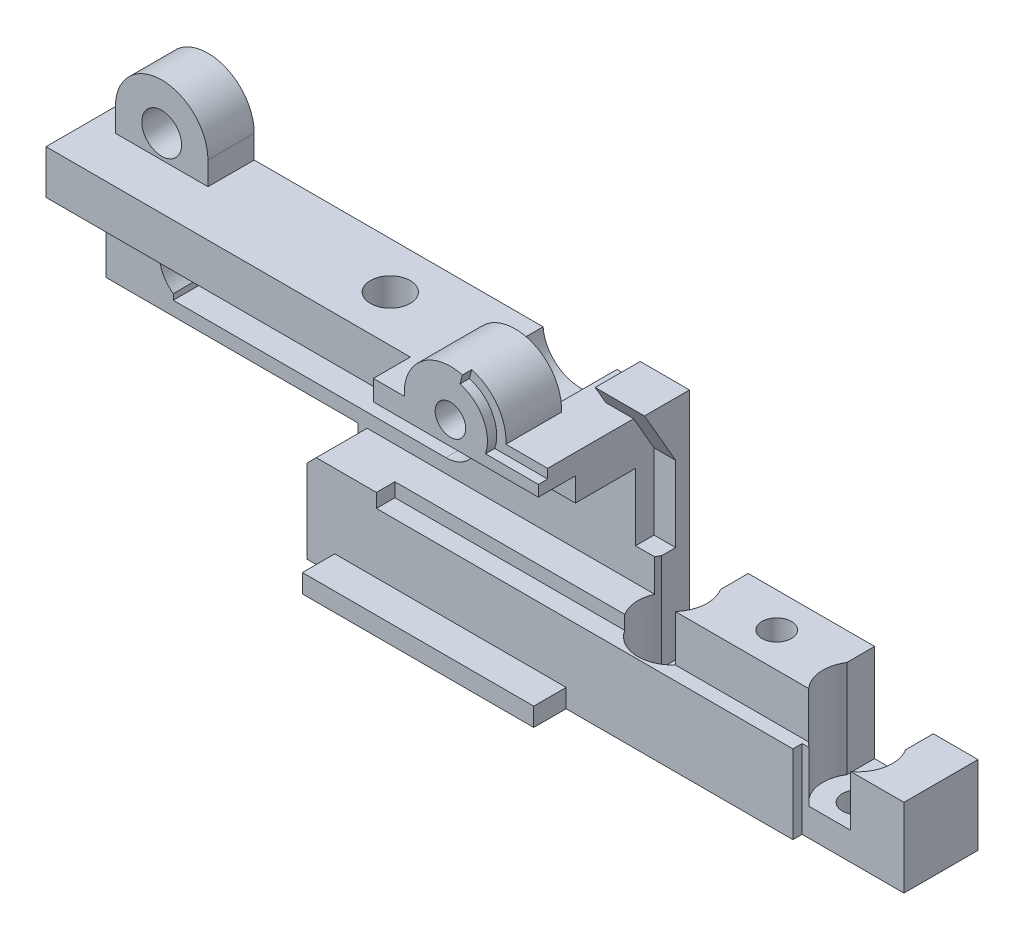
from build123d import *
from build123d.topology import SkipClean

# Parameters (mm, degrees)
SKETCH_1_W                   = 63.5
SKETCH_1_H                   = 8
SKETCH_1_R                   = 1.65
EXTRUDE_1_DEPTH              = 3
SKETCH_4_W                   = 52.5
SKETCH_4_H                   = 1
EXTRUDE_3_DEPTH              = 3
EXTRUDE_4_DEPTH              = 5.5
EXTRUDE_5_DEPTH              = 1.5
EXTRUDE_5_DIRECTION_2_REACH  = 38.844
CHAMFER_1_SIZE               = 1
SKETCH_8_W                   = 22
SKETCH_8_H                   = 3.5
EXTRUDE_6_DEPTH              = 12.5
EXTRUDE_7_DEPTH              = 5
SKETCH_11_W                  = 10
SKETCH_11_H                  = 2
CUT_EXTRUDE_1_DEPTH          = 5
CUT_EXTRUDE_3_DEPTH          = 43.388087949
EXTRUDE_8_DEPTH              = 3.5
SKETCH_16_W                  = 3.5
SKETCH_16_H                  = 4
EXTRUDE_9_DEPTH              = 8
SKETCH_2_W                   = 10
SKETCH_2_H                   = 2
EXTRUDE_2_DEPTH              = 3
SKETCH_17_W                  = 30
SKETCH_17_H                  = 4.75
EXTRUDE_10_DEPTH             = 10
EXTRUDE_11_DEPTH             = 17
EXTRUDE_12_REACH             = 44.326
SKETCH_19_W                  = 2.327855615
SKETCH_19_H                  = 3
SKETCH_19_W_2                = 13.65571123
SKETCH_19_W_3                = 4.827855615
SKETCH_21_R                  = 1.65
CUT_EXTRUDE_4_DEPTH          = 45.838599443
EXTRUDE_13_DEPTH             = 4
EXTRUDE_13_DEPTH_BACK        = 3
SKETCH_23_R                  = 4
CUT_EXTRUDE_5_DEPTH          = 48.517260022
SKETCH_24_W                  = 5.169872981
SKETCH_24_H                  = 2.2
SKETCH_24_W_2                = 4
EXTRUDE_14_DEPTH             = 4
CUT_EXTRUDE_6_DEPTH          = 1
SKETCH_26_R                  = 2.15
CUT_EXTRUDE_7_DEPTH          = 4.75
EXTRUDE_15_DEPTH             = 3.5
SKETCH_28_W                  = 6.5
SKETCH_28_H                  = 4.75
EXTRUDE_16_DEPTH             = 27.2
SKETCH_29_R                  = 2.15
EXTRUDE_17_DEPTH             = 5
SKETCH_30_R                  = 1.6
CUT_EXTRUDE_8_DEPTH          = 5
SKETCH_31_W                  = 28
SKETCH_31_H                  = 2
EXTRUDE_18_DEPTH             = 3.5
CUT_EXTRUDE_9_DEPTH          = 2.5
EXTRUDE_19_DEPTH             = 1.5
SKETCH_34_W                  = 4
SKETCH_34_H                  = 12
CUT_EXTRUDE_10_DEPTH         = 67.647130471
SKETCH_35_W                  = 4.827855615
SKETCH_35_H                  = 3
CUT_EXTRUDE_11_DEPTH         = 5
SKETCH_36_W                  = 2.327855615
SKETCH_36_H                  = 1.5
EXTRUDE_20_DEPTH             = 14
SKETCH_37_W                  = 3
SKETCH_37_H                  = 1.5
EXTRUDE_21_DEPTH             = 2
SKETCH_38_W                  = 3
SKETCH_38_H                  = 3.5
CUT_EXTRUDE_12_DEPTH         = 10
SKETCH_39_W                  = 2
SKETCH_39_H                  = 7
CUT_EXTRUDE_13_DEPTH         = 3.5
EXTRUDE_22_REACH             = 68.647
EXTRUDE_22_DIRECTION_2_REACH = 68.647


with BuildPart() as part:
    # 草图1 → 凸台-拉伸1 (new body)
    with BuildSketch(Plane(origin=(0, 0, 0), x_dir=(1, 0, 0), z_dir=(0, 1, 0))):
        with Locations((-3.75, 1)):
            Rectangle(SKETCH_1_W, SKETCH_1_H)
        with Locations(Location((0, 0, 0), (0, 0, 270))):
            Circle(SKETCH_1_R, mode=Mode.SUBTRACT)
        with Locations(Location((20, 0, 0), (0, 0, 270))):
            Circle(SKETCH_1_R, mode=Mode.SUBTRACT)
    extrude(amount=EXTRUDE_1_DEPTH)

    # 草图4 → 凸台-拉伸3 (add)
    with BuildSketch(Plane(origin=(0, 3, 0), x_dir=(1, 0, 0), z_dir=(0, 1, 0))):
        with Locations((-9.25, -3.5)):
            Rectangle(SKETCH_4_W, SKETCH_4_H)
    extrude(amount=-EXTRUDE_3_DEPTH)

    # 草图6 → 凸台-拉伸4 (add)
    with BuildSketch(Plane(origin=(0, 3, 0), x_dir=(1, 0, 0), z_dir=(0, 1, 0))):
        with BuildLine():
            Line((-35.5, -4), (17, -4))
            Line((17, -4), (17, -3))
            Line((17, -3), (17.75, -3))
            ThreePointArc((17.75, -3), (16.31219409, -0.680137903), (16.827855615, 2))
            Line((16.827855615, 2), (3.172144385, 2))
            ThreePointArc((3.172144385, 2), (0, -3.75), (-3.172144385, 2))
            Line((-3.172144385, 2), (-35.5, 2))
            Line((-35.5, 2), (-35.5, -4))
        make_face()
        with BuildLine():
            Line((28, -3), (28, 2))
            Line((28, 2), (23.172144385, 2))
            ThreePointArc((23.172144385, 2), (23.68780591, -0.680137903), (22.25, -3))
            Line((22.25, -3), (28, -3))
        make_face()
    extrude(amount=EXTRUDE_4_DEPTH)

    # 草图7 → 凸台-拉伸5 (add)
    with BuildSketch(Plane(origin=(0, 8.5, 0), x_dir=(1, 0, 0), z_dir=(0, 1, 0))):
        Polygon((-18, -4), (-35.5, -4), (-35.5, 5), (-5.5, 5), (-5.5, 0), (-18, 0), align=None)
    extrude(amount=EXTRUDE_5_DEPTH)

    # 草图7 → 凸台-拉伸5 direction 2 (add, up to next)
    with BuildSketch(Plane(origin=(0, 8.5, 0), x_dir=(1, 0, 0), z_dir=(0, 1, 0)), mode=Mode.PRIVATE) as extrude_5_direction_2_sk1:
        Polygon((-18, -4), (-35.5, -4), (-35.5, 5), (-5.5, 5), (-5.5, 0), (-18, 0), align=None)
    extrude_5_direction_2_tool1 = extrude(extrude_5_direction_2_sk1.sketch, amount=-EXTRUDE_5_DIRECTION_2_REACH, mode=Mode.PRIVATE) - part.part
    add(extrude_5_direction_2_tool1.solids().sort_by_distance((-22.488636, 8.5, -1.068182))[0])

    # 倒角1
    chamfer_1_edges = [part.edges().sort_by_distance(p)[0] for p in [
        (-35.5, 10, -0.5),
    ]]
    chamfer(chamfer_1_edges, length=CHAMFER_1_SIZE)

    # 草图8 → 凸台-拉伸6 (add)
    with BuildSketch(Plane(origin=(0, 10, 0), x_dir=(1, 0, 0), z_dir=(0, 1, 0))):
        with Locations((-16.5, 3.25)):
            Rectangle(SKETCH_8_W, SKETCH_8_H)
    extrude(amount=EXTRUDE_6_DEPTH)

    # 草图10 → 凸台-拉伸7 (add)
    with BuildSketch(Plane(origin=(0, 8.5, 0), x_dir=(1, 0, 0), z_dir=(0, 1, 0))):
        with BuildLine():
            Line((2.795084972, -2.5), (17.204915028, -2.5))
            ThreePointArc((17.204915028, -2.5), (16.263095325, -0.313118908), (16.827855615, 2))
            Line((16.827855615, 2), (3.172144385, 2))
            ThreePointArc((3.172144385, 2), (3.736904675, -0.313118908), (2.795084972, -2.5))
        make_face()
    extrude(amount=EXTRUDE_7_DEPTH)

    # 草图11 → 切除-拉伸1 (cut)
    with BuildSketch(Plane(origin=(0, 8.5, 0), x_dir=(1, 0, 0), z_dir=(0, 1, 0))):
        with Locations((-23, -3)):
            Rectangle(SKETCH_11_W, SKETCH_11_H)
    extrude(amount=CUT_EXTRUDE_1_DEPTH, mode=Mode.SUBTRACT)

    # 草图14 → 切除-拉伸3 (cut, through all)
    with BuildSketch(Plane.XY.offset(-1.5)):
        with BuildLine():
            Line((-27.5, 18.5), (-26, 18.5))
            ThreePointArc((-26, 18.5), (-22.5, 15), (-26, 11.5))
            Line((-26, 11.5), (-27.5, 11.5))
            ThreePointArc((-27.5, 11.5), (-31, 15), (-27.5, 18.5))
        make_face()
    extrude(amount=-CUT_EXTRUDE_3_DEPTH, mode=Mode.SUBTRACT)

    # 草图15 → 凸台-拉伸8 (add)
    with BuildSketch(Plane.XY.offset(-1.5)):
        Polygon((-27.5, 10), (-34.5, 10), (-35.5, 9), (-35.5, 11.5), (-27.5, 11.5), align=None)
    extrude(amount=-EXTRUDE_8_DEPTH)

    # 草图16 → 凸台-拉伸9 (add)
    with BuildSketch(Plane.ZY.offset(27.5)):
        with Locations((-3.25, 20.5)):
            Rectangle(SKETCH_16_W, SKETCH_16_H)
    extrude(amount=EXTRUDE_9_DEPTH)

    # 草图2 → 凸台-拉伸2 (add)
    with BuildSketch(Plane(origin=(0, 3, 0), x_dir=(1, 0, 0), z_dir=(0, 1, 0))):
        with Locations((10, -2)):
            Rectangle(SKETCH_2_W, SKETCH_2_H)
    extrude(amount=EXTRUDE_2_DEPTH)

    # 草图17 → 凸台-拉伸10 (add)
    with BuildSketch(Plane(origin=(0, 0, -5), x_dir=(-1, 0, 0), z_dir=(0, 0, -1))):
        with Locations((20.5, 23.125)):
            Rectangle(SKETCH_17_W, SKETCH_17_H)
    extrude(amount=-EXTRUDE_10_DEPTH)

    # 草图18 → 凸台-拉伸11 (add)
    with BuildSketch(Plane(origin=(0, 8.5, 0), x_dir=(1, 0, 0), z_dir=(0, 1, 0))):
        with BuildLine():
            Line((-5.5, 2), (-5.5, -2))
            Line((-5.5, -2), (-3.172144385, -2))
            ThreePointArc((-3.172144385, -2), (-3.75, 0), (-3.172144385, 2))
            Line((-3.172144385, 2), (-5.5, 2))
        make_face()
    extrude(amount=EXTRUDE_11_DEPTH)

    # 凸台-拉伸12: up to this face of the body (flat: up to its plane)
    extrude_12_end = Plane(part.part.faces().sort_by_distance((10, 13.5, 0.269728819))[0])
    # 草图19 → 凸台-拉伸12 (add, up to the picked face)
    with BuildSketch(Plane(origin=(0, 3, 0), x_dir=(1, 0, 0), z_dir=(0, 1, 0)), mode=Mode.PRIVATE) as extrude_12_sk1:
        with Locations((-4.336072192, 3.5)):
            Rectangle(SKETCH_19_W, SKETCH_19_H)
    extrude_12_tool1 = split(extrude(extrude_12_sk1.sketch, amount=EXTRUDE_12_REACH, mode=Mode.PRIVATE), bisect_by=extrude_12_end, keep=Keep.BOTH, mode=Mode.PRIVATE)
    # 草图19 → 凸台-拉伸12 (add, up to the picked face)
    with BuildSketch(Plane(origin=(0, 3, 0), x_dir=(1, 0, 0), z_dir=(0, 1, 0)), mode=Mode.PRIVATE) as extrude_12_sk2:
        with Locations((10, 3.5)):
            Rectangle(SKETCH_19_W_2, SKETCH_19_H)
    extrude_12_tool2 = split(extrude(extrude_12_sk2.sketch, amount=EXTRUDE_12_REACH, mode=Mode.PRIVATE), bisect_by=extrude_12_end, keep=Keep.BOTH, mode=Mode.PRIVATE)
    # 草图19 → 凸台-拉伸12 (add, up to the picked face)
    with BuildSketch(Plane(origin=(0, 3, 0), x_dir=(1, 0, 0), z_dir=(0, 1, 0)), mode=Mode.PRIVATE) as extrude_12_sk3:
        with Locations((25.586072193, 3.5)):
            Rectangle(SKETCH_19_W_3, SKETCH_19_H)
    extrude_12_tool3 = split(extrude(extrude_12_sk3.sketch, amount=EXTRUDE_12_REACH, mode=Mode.PRIVATE), bisect_by=extrude_12_end, keep=Keep.BOTH, mode=Mode.PRIVATE)
    add(extrude_12_tool1.solids().sort_by(Axis((-4.336072, 3, -3.5), (0, 1, 0)))[0])
    add(extrude_12_tool2.solids().sort_by(Axis((10, 3, -3.5), (0, 1, 0)))[0])
    add(extrude_12_tool3.solids().sort_by(Axis((25.586072, 3, -3.5), (0, 1, 0)))[0])

    # 草图21 → 切除-拉伸4 (cut, through all)
    with BuildSketch(Plane(origin=(0, 0, -5), x_dir=(-1, 0, 0), z_dir=(0, 0, -1))):
        with Locations((15, 25.8)):
            Circle(SKETCH_21_R)
    extrude(amount=-CUT_EXTRUDE_4_DEPTH, mode=Mode.SUBTRACT)

    # 草图22 → 凸台-拉伸13 (add, two sides: drawn at the far end of the back side and taken through both)
    with BuildSketch(Plane.XY.offset(5).offset(-EXTRUDE_13_DEPTH_BACK)):
        with BuildLine():
            ThreePointArc((-19.990991885, 25.5), (-19.788612994, 24.361533597), (-19.330127019, 23.3))
            Line((-19.330127019, 23.3), (-10.669872981, 23.3))
            ThreePointArc((-10.669872981, 23.3), (-10.211387006, 24.361533597), (-10.009008115, 25.5))
            Line((-10.009008115, 25.5), (-13.377501926, 25.5))
            ThreePointArc((-13.377501926, 25.5), (-15, 24.15), (-16.622498074, 25.5))
            Line((-16.622498074, 25.5), (-19.990991885, 25.5))
        make_face()
        with BuildLine():
            ThreePointArc((-10.009008115, 25.5), (-15, 30.8), (-19.990991885, 25.5))
            Line((-19.990991885, 25.5), (-16.622498074, 25.5))
            ThreePointArc((-16.622498074, 25.5), (-15.150628978, 27.443110134), (-13.35, 25.8))
            ThreePointArc((-13.35, 25.8), (-13.356889866, 25.649371022), (-13.377501926, 25.5))
            Line((-13.377501926, 25.5), (-10.009008115, 25.5))
        make_face()
    extrude(amount=EXTRUDE_13_DEPTH + EXTRUDE_13_DEPTH_BACK)

    # 草图23 → 切除-拉伸5 (cut, through all)
    with BuildSketch(Plane(origin=(0, 0, 2), x_dir=(-1, 0, 0), z_dir=(0, 0, -1))):
        with Locations((15, 25.8)):
            Circle(SKETCH_23_R)
    extrude(amount=CUT_EXTRUDE_5_DEPTH, mode=Mode.SUBTRACT)

    # 草图24 → 凸台-拉伸14 (add)
    with BuildSketch(Plane.XY.offset(5)):
        with Locations((-8.084936491, 24.4)):
            Rectangle(SKETCH_24_W, SKETCH_24_H)
        with Locations((-21.330127019, 24.4)):
            Rectangle(SKETCH_24_W_2, SKETCH_24_H)
    extrude(amount=EXTRUDE_14_DEPTH)

    # 草图25 → 切除-拉伸6 (cut)
    with BuildSketch(Plane.XY.offset(9)):
        with BuildLine():
            Line((-13.96472382, 29.663703305), (-13.705904774, 30.629629131))
            ThreePointArc((-13.705904774, 30.629629131), (-10.943664985, 28.723379251), (-10.009008115, 25.5))
            Line((-10.009008115, 25.5), (-5.5, 25.5))
            Line((-5.5, 25.5), (-5.5, 24.5))
            Line((-5.5, 24.5), (-11.217143936, 24.5))
            ThreePointArc((-11.217143936, 24.5), (-11.468773933, 27.678947169), (-13.96472382, 29.663703305))
        make_face()
    extrude(amount=-CUT_EXTRUDE_6_DEPTH, mode=Mode.SUBTRACT)

    # 草图26 → 切除-拉伸7 (cut)
    with BuildSketch(Plane(origin=(0, 25.5, 0), x_dir=(1, 0, 0), z_dir=(0, 1, 0))):
        with Locations(Location((-30.5, 0, 0), (0, 0, 270))):
            Circle(SKETCH_26_R)
    extrude(amount=-CUT_EXTRUDE_7_DEPTH, mode=Mode.SUBTRACT)

    # 草图27 → 凸台-拉伸15 (add)
    with BuildSketch(Plane(origin=(0, 0, -5), x_dir=(-1, 0, 0), z_dir=(0, 0, -1))):
        with BuildLine():
            Line((35.5, 10), (62.7, 10))
            Line((62.7, 10), (62.7, 25.5))
            Line((62.7, 25.5), (35.5, 25.5))
            Line((35.5, 25.5), (35.5, 18.5))
            Line((35.5, 18.5), (53.45, 18.5))
            ThreePointArc((53.45, 18.5), (56.95, 15), (53.45, 11.5))
            Line((53.45, 11.5), (35.5, 11.5))
            Line((35.5, 11.5), (35.5, 10))
        make_face()
    extrude(amount=-EXTRUDE_15_DEPTH)

    # 草图28 → 凸台-拉伸16 (add)
    with BuildSketch(Plane.ZY.offset(35.5)):
        with Locations((1.75, 23.125)):
            Rectangle(SKETCH_28_W, SKETCH_28_H)
    extrude(amount=EXTRUDE_16_DEPTH)

    # 草图29 → 凸台-拉伸17 (add)
    with BuildSketch(Plane(origin=(0, 0, -5), x_dir=(-1, 0, 0), z_dir=(0, 0, -1))):
        with BuildLine():
            Line((60.2, 28), (60.2, 25.5))
            Line((60.2, 25.5), (50.2, 25.5))
            Line((50.2, 25.5), (50.2, 28))
            ThreePointArc((50.2, 28), (55.2, 33), (60.2, 28))
        make_face()
        with Locations((55.2, 28)):
            Circle(SKETCH_29_R, mode=Mode.SUBTRACT)
    extrude(amount=-EXTRUDE_17_DEPTH)

    # 草图30 → 切除-拉伸8 (cut)
    with BuildSketch(Plane(origin=(0, 13.5, 0), x_dir=(1, 0, 0), z_dir=(0, 1, 0))):
        with Locations(Location((10, 1.25, 0), (0, 0, 270))):
            Circle(SKETCH_30_R)
    extrude(amount=-CUT_EXTRUDE_8_DEPTH, mode=Mode.SUBTRACT)

    # 草图31 → 凸台-拉伸18 (add)
    with BuildSketch(Plane.XY.offset(4)):
        with Locations((-21.5, 1)):
            Rectangle(SKETCH_31_W, SKETCH_31_H)
    extrude(amount=EXTRUDE_18_DEPTH)

    # 草图32 → 切除-拉伸9 (cut)
    with BuildSketch(Plane.ZY.offset(5.5)):
        Polygon((-1.5, 10), (0, 10), (0, 8.5), (2, 8.5), (2, 20.75), (-1.5, 20.75), align=None)
    extrude(amount=-CUT_EXTRUDE_9_DEPTH, mode=Mode.SUBTRACT)

    # 草图33 → 凸台-拉伸19 (add)
    with SkipClean():  # the faces are left unmerged after this step: merging them gives an invalid solid
        with BuildSketch(Plane(origin=(0, 8.5, 0), x_dir=(1, 0, 0), z_dir=(0, 1, 0))):
            with BuildLine():
                Line((-18, 0), (-3.75, 0))
                ThreePointArc((-3.75, 0), (-3.602640798, -1.040903107), (-3.172144385, -2))
                Line((-3.172144385, -2), (-18, -2))
                Line((-18, -2), (-18, 0))
            make_face()
        extrude(amount=EXTRUDE_19_DEPTH)

    # 草图34 → 切除-拉伸10 (cut, through all)
    with BuildSketch(Plane(origin=(-5.5, 0, 0), x_dir=(0, 0, -1), z_dir=(1, 0, 0))):
        with Locations((0, 19.5)):
            Rectangle(SKETCH_34_W, SKETCH_34_H)
    extrude(amount=CUT_EXTRUDE_10_DEPTH, mode=Mode.SUBTRACT)

    # 草图35 → 切除-拉伸11 (cut)
    with BuildSketch(Plane(origin=(0, 13.5, 0), x_dir=(1, 0, 0), z_dir=(0, 1, 0))):
        with Locations((25.586072193, 3.5)):
            Rectangle(SKETCH_35_W, SKETCH_35_H)
    extrude(amount=-CUT_EXTRUDE_11_DEPTH, mode=Mode.SUBTRACT)

    # 草图36 → 凸台-拉伸20 (add)
    with BuildSketch(Plane(origin=(0, 13.5, 0), x_dir=(1, 0, 0), z_dir=(0, 1, 0))):
        with Locations((-4.336072192, 4.25)):
            Rectangle(SKETCH_36_W, SKETCH_36_H)
    extrude(amount=EXTRUDE_20_DEPTH)

    # 草图37 → 凸台-拉伸21 (add)
    with SkipClean():  # the faces are left unmerged after this step: merging them gives an invalid solid
        with BuildSketch(Plane(origin=(0, 25.5, 0), x_dir=(1, 0, 0), z_dir=(0, 1, 0))):
            with Locations((-7, 4.25)):
                Rectangle(SKETCH_37_W, SKETCH_37_H)
        extrude(amount=EXTRUDE_21_DEPTH)

    # 草图38 → 切除-拉伸12 (cut)
    with SkipClean():  # the faces are left unmerged after this step: merging them gives an invalid solid
        with BuildSketch(Plane(origin=(0, 2, 0), x_dir=(1, 0, 0), z_dir=(0, 1, 0))):
            with Locations((-34, -5.75)):
                Rectangle(SKETCH_38_W, SKETCH_38_H)
        extrude(amount=-CUT_EXTRUDE_12_DEPTH, mode=Mode.SUBTRACT)

    # 草图39 → 切除-拉伸13 (cut)
    with BuildSketch(Plane(origin=(0, 0, -5), x_dir=(-1, 0, 0), z_dir=(0, 0, -1))):
        with Locations((54.45, 15)):
            Rectangle(SKETCH_39_W, SKETCH_39_H)
    extrude(amount=-CUT_EXTRUDE_13_DEPTH, mode=Mode.SUBTRACT)

    # 凸台-拉伸22: up to this face of the body (flat: up to its plane)
    extrude_22_end = Plane(part.part.faces().sort_by_distance((-3.172144385, 13.15, -3.8))[0])
    # 草图40 → 凸台-拉伸22 (add, up to the picked face)
    with BuildSketch(Plane(origin=(-5.5, 0, 0), x_dir=(0, 0, -1), z_dir=(1, 0, 0)), mode=Mode.PRIVATE) as extrude_22_sk1:
        Polygon((3.5, 27.5), (0.133974596, 27.5), (3.5, 21.669872981), align=None)
    extrude_22_tool1 = split(extrude(extrude_22_sk1.sketch, amount=EXTRUDE_22_REACH, mode=Mode.PRIVATE), bisect_by=extrude_22_end, keep=Keep.BOTH, mode=Mode.PRIVATE)
    add(extrude_22_tool1.solids().sort_by(Axis((-5.5, 25.556624, -2.377992), (1, 0, 0)))[0])

    # 凸台-拉伸22 direction 2: up to this face of the body (flat: up to its plane)
    extrude_22_direction_2_end = Plane(part.part.faces().sort_by_distance((-8.5, 26.5, -4.25))[0])
    # 草图40 → 凸台-拉伸22 direction 2 (add, up to the picked face)
    with BuildSketch(Plane(origin=(-5.5, 0, 0), x_dir=(0, 0, -1), z_dir=(1, 0, 0)), mode=Mode.PRIVATE) as extrude_22_direction_2_sk1:
        Polygon((3.5, 27.5), (0.133974596, 27.5), (3.5, 21.669872981), align=None)
    extrude_22_direction_2_tool1 = split(extrude(extrude_22_direction_2_sk1.sketch, amount=-EXTRUDE_22_DIRECTION_2_REACH, mode=Mode.PRIVATE), bisect_by=extrude_22_direction_2_end, keep=Keep.BOTH, mode=Mode.PRIVATE)
    add(extrude_22_direction_2_tool1.solids().sort_by(Axis((-5.5, 25.556624, -2.377992), (-1, 0, 0)))[0])


solid = part.part
